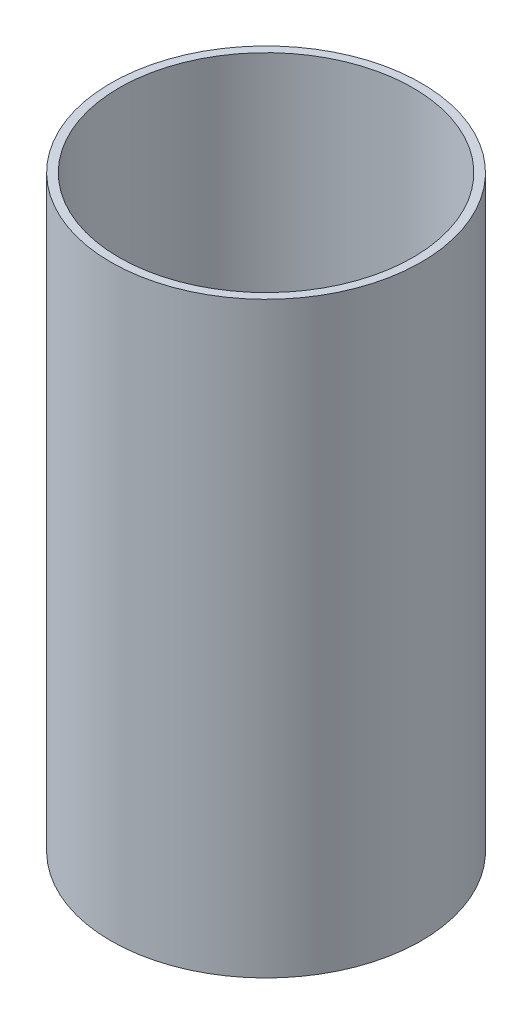
from build123d import *

# Parameters (mm, degrees)
SKETCH1_R           = 33.528
SKETCH1_R_2         = 31.75
BOSS_EXTRUDE1_DEPTH = 127


with BuildPart() as part:
    # Sketch1 → Boss-Extrude1 (new body)
    with BuildSketch(Plane(origin=(0, 0, 0), x_dir=(1, 0, 0), z_dir=(0, 1, 0))):
        with Locations(Location((0, 0, 0), (0, 0, 270))):
            Circle(SKETCH1_R)
        with Locations(Location((0, 0, 0), (0, 0, 270))):
            Circle(SKETCH1_R_2, mode=Mode.SUBTRACT)
    extrude(amount=BOSS_EXTRUDE1_DEPTH)


solid = part.part
